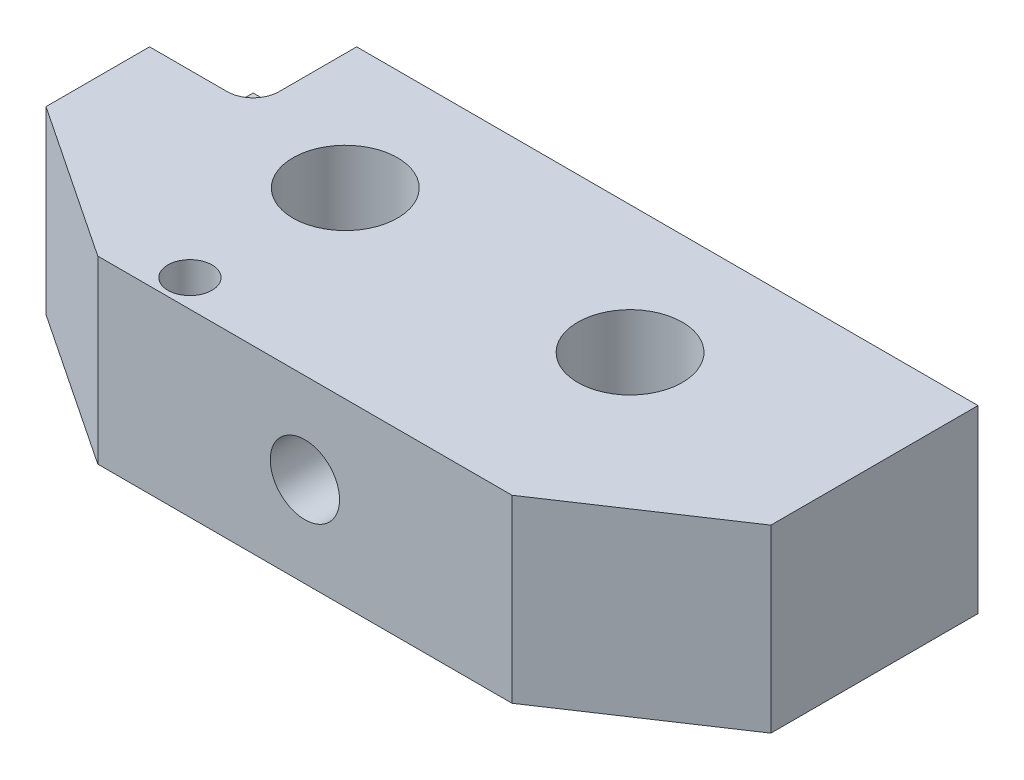
from build123d import *

# Parameters (mm, degrees)
BOSS_EXTRUDE1_DEPTH     = 22.098
CUT_EXTRUDE1_DEPTH      = 11.2522
M10X1_5_TAPPED_HOLE1_D  = 8.5
SKETCH6_R               = 6.4135
CUT_EXTRUDE2_DEPTH      = 54.169790332
F_1_4_28_TAPPED_HOLE1_D = 5.4102


with BuildPart() as part:
    # Sketch1 → Boss-Extrude1 (new body)
    with BuildSketch(Plane(origin=(0, 0, 0), x_dir=(1, 0, 0), z_dir=(0, 1, 0))):
        Polygon((-44.45, -6.35), (-25.4, -19.05), (25.4, -19.05), (44.45, -6.35), (44.45, 19.05), (-44.45, 19.05), align=None)
    extrude(amount=BOSS_EXTRUDE1_DEPTH)

    # Sketch2 → Cut-Extrude1 (cut)
    with BuildSketch(Plane(origin=(0, 22.098, 0), x_dir=(1, 0, 0), z_dir=(0, 1, 0))):
        with BuildLine():
            Line((-31.75, 19.05), (-31.75, 9.525))
            ThreePointArc((-31.75, 9.525), (-32.67993597, 7.27993597), (-34.925, 6.35))
            Line((-34.925, 6.35), (-44.45, 6.35))
            Line((-44.45, 6.35), (-44.45, 19.05))
            Line((-44.45, 19.05), (-31.75, 19.05))
        make_face()
    extrude(amount=-CUT_EXTRUDE1_DEPTH, mode=Mode.SUBTRACT)

    # M10x1.5 Tapped Hole1 (through all)
    with Locations(Plane.XY.offset(19.05)):
        with Locations((0, 11.049)):
            Hole(M10X1_5_TAPPED_HOLE1_D / 2)

    # Sketch6 → Cut-Extrude2 (cut, through all)
    with BuildSketch(Plane(origin=(0, 22.098, 0), x_dir=(1, 0, 0), z_dir=(0, 1, 0))):
        with Locations(Location((-17.4625, 3.364454491, 0), (0, 0, 270))):
            Circle(SKETCH6_R)
        with Locations(Location((17.4625, 3.364454491, 0), (0, 0, 90))):
            Circle(SKETCH6_R)
    extrude(amount=-CUT_EXTRUDE2_DEPTH, mode=Mode.SUBTRACT)

    # 1/4-28 Tapped Hole1 (through all)
    with Locations(Plane.XZ):
        with Locations((-17.4625, 15.685545509)):
            Hole(F_1_4_28_TAPPED_HOLE1_D / 2)


solid = part.part
